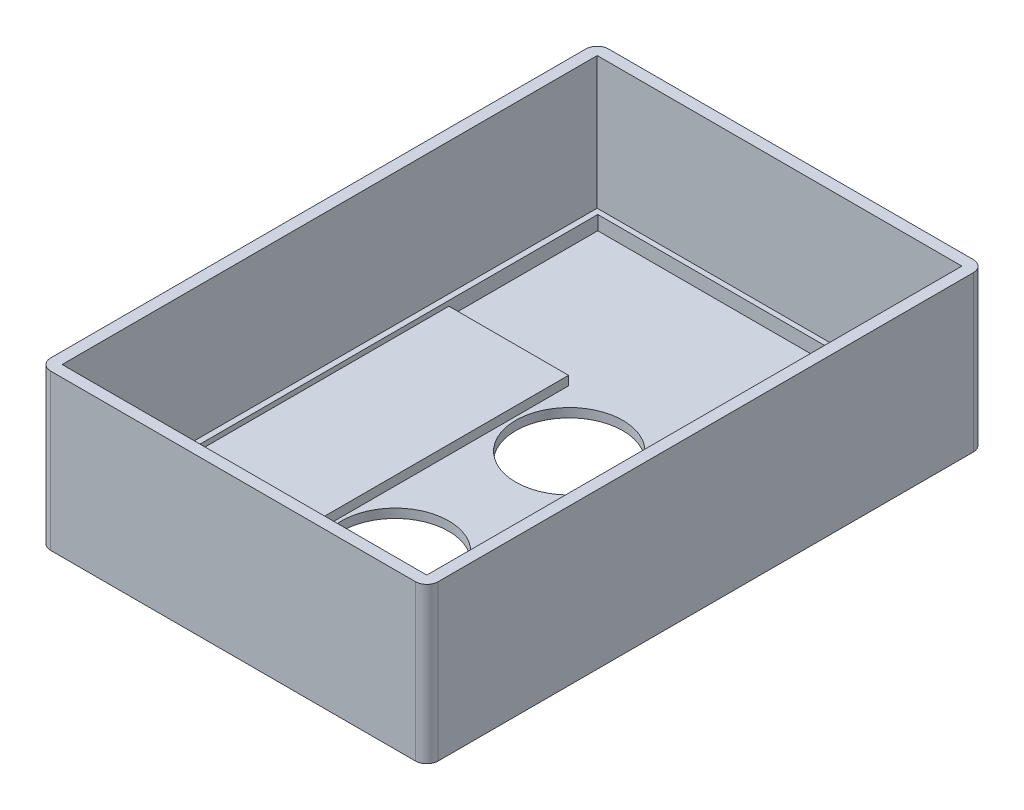
from build123d import *

# Parameters (mm, degrees)
SKETCH1_W           = 86.36
SKETCH1_H           = 124.333
BOSS_EXTRUDE1_DEPTH = 34.6202
SKETCH3_W           = 78.74
SKETCH3_H           = 116.84
CUT_EXTRUDE1_DEPTH  = 30.5816
SKETCH4_W           = 81.28
SKETCH4_H           = 119.253
CUT_EXTRUDE2_DEPTH  = 29.464
CUT_EXTRUDE3_DEPTH  = 2.032
SKETCH8_R           = 11.938
CUT_EXTRUDE4_DEPTH  = 2.032
FILLET1_R           = 2.54


with BuildPart() as part:
    # Sketch1 → Boss-Extrude1 (new body)
    with BuildSketch(Plane(origin=(0, 0, 0), x_dir=(1, 0, 0), z_dir=(0, 1, 0))):
        with Locations((43.18, 62.1665)):
            Rectangle(SKETCH1_W, SKETCH1_H)
    extrude(amount=BOSS_EXTRUDE1_DEPTH)

    # Sketch3 → Cut-Extrude1 (cut)
    with BuildSketch(Plane(origin=(0, 34.6202, 0), x_dir=(1, 0, 0), z_dir=(0, 1, 0))):
        with Locations((43.18, 62.23)):
            Rectangle(SKETCH3_W, SKETCH3_H)
    extrude(amount=-CUT_EXTRUDE1_DEPTH, mode=Mode.SUBTRACT)

    # Sketch4 → Cut-Extrude2 (cut)
    with BuildSketch(Plane(origin=(0, 34.6202, 0), x_dir=(1, 0, 0), z_dir=(0, 1, 0))):
        with Locations((43.18, 62.1665)):
            Rectangle(SKETCH4_W, SKETCH4_H)
    extrude(amount=-CUT_EXTRUDE2_DEPTH, mode=Mode.SUBTRACT)

    # Sketch6 → Cut-Extrude3 (cut)
    with BuildSketch(Plane(origin=(0, 4.0386, 0), x_dir=(1, 0, 0), z_dir=(0, 1, 0))):
        Polygon((3.81, 120.65), (82.55, 120.65), (82.55, 87.471955448), (55.88, 87.471955448), (55.88, 3.81), (30.48, 3.81), (30.48, 87.471955448), (3.81, 87.471955448), align=None)
    extrude(amount=-CUT_EXTRUDE3_DEPTH, mode=Mode.SUBTRACT)

    # Sketch8 → Cut-Extrude4 (cut)
    with BuildSketch(Plane(origin=(0, 2.0066, 0), x_dir=(1, 0, 0), z_dir=(0, 1, 0))):
        with Locations(Location((43.18, 36.1188, 0), (0, 0, 270))):
            Circle(SKETCH8_R)
        with Locations(Location((43.18, 74.93, 0), (0, 0, 270))):
            Circle(SKETCH8_R)
    extrude(amount=-CUT_EXTRUDE4_DEPTH, mode=Mode.SUBTRACT)

    # Fillet1
    fillet1_edges = [part.edges().sort_by_distance(p)[0] for p in [
        (86.36, 17.3101, 0),
        (0, 17.3101, 0),
        (0, 17.3101, -124.333),
        (86.36, 17.3101, -124.333),
    ]]
    fillet(fillet1_edges, radius=FILLET1_R)


solid = part.part
